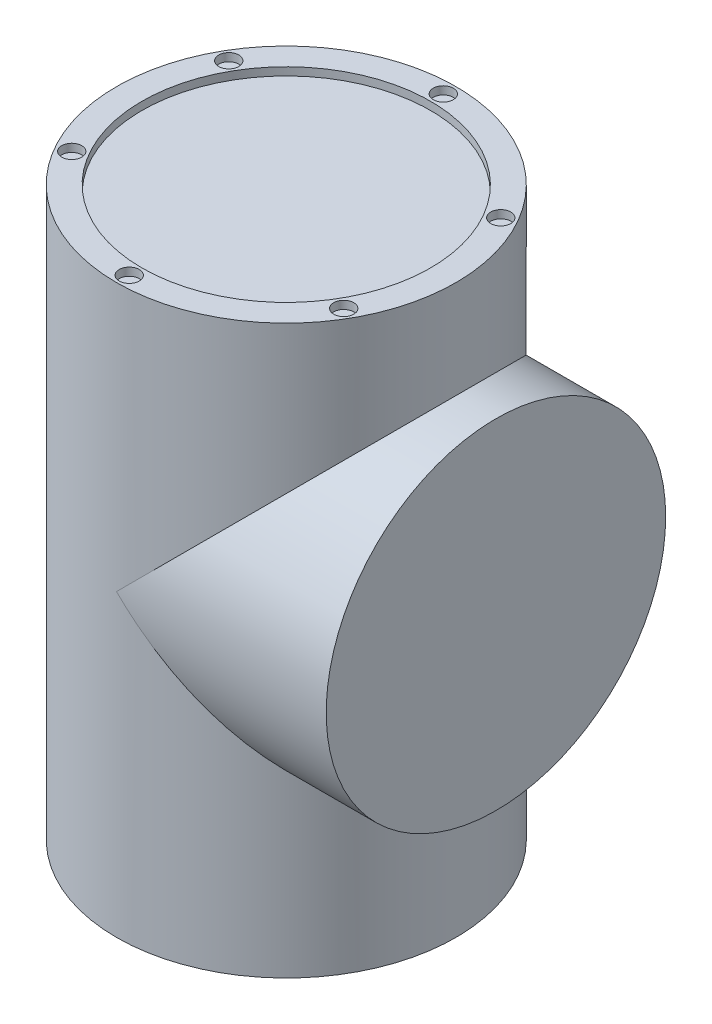
from build123d import *

# Parameters (mm, degrees)
CROQUIS1_R              = 42.5
SALIENTE_EXTRUIR1_DEPTH = 140
CROQUIS2_R              = 42.5
SALIENTE_EXTRUIR2_DEPTH = 52.5
CROQUIS3_R              = 42.5
CROQUIS3_R_2            = 36.143595246
CROQUIS3_R_3            = 2.508178933
SALIENTE_EXTRUIR3_DEPTH = 2


with BuildPart() as part:
    # Croquis1 → Saliente-Extruir1 (new body)
    with BuildSketch(Plane(origin=(0, 0, 0), x_dir=(1, 0, 0), z_dir=(0, 1, 0))):
        with Locations(Location((0, 0, 0), (0, 0, 270))):
            Circle(CROQUIS1_R)
    extrude(amount=SALIENTE_EXTRUIR1_DEPTH)

    # Croquis2 → Saliente-Extruir2 (add)
    with BuildSketch(Plane(origin=(0, 0, 0), x_dir=(0, 0, -1), z_dir=(1, 0, 0))):
        with Locations((0, 75)):
            Circle(CROQUIS2_R)
    extrude(amount=SALIENTE_EXTRUIR2_DEPTH)

    # Croquis3 → Saliente-Extruir3 (add)
    with BuildSketch(Plane(origin=(0, 140, 0), x_dir=(1, 0, 0), z_dir=(0, 1, 0))):
        with Locations(Location((0, 0, 0), (0, 0, 270))):
            Circle(CROQUIS3_R)
        with Locations(Location((0, 0, 0), (0, 0, 270))):
            Circle(CROQUIS3_R_2, mode=Mode.SUBTRACT)
        with Locations(Location((0, 39.319059372, 0), (0, 0, 270))):
            Circle(CROQUIS3_R_3, mode=Mode.SUBTRACT)
        with Locations(Location((34.051304269, 19.659529686, 0), (0, 0, 270))):
            Circle(CROQUIS3_R_3, mode=Mode.SUBTRACT)
        with Locations(Location((34.051304269, -19.659529686, 0), (0, 0, 270))):
            Circle(CROQUIS3_R_3, mode=Mode.SUBTRACT)
        with Locations(Location((0, -39.319059372, 0), (0, 0, 270))):
            Circle(CROQUIS3_R_3, mode=Mode.SUBTRACT)
        with Locations(Location((-34.051304269, -19.659529686, 0), (0, 0, 270))):
            Circle(CROQUIS3_R_3, mode=Mode.SUBTRACT)
        with Locations(Location((-34.051304269, 19.659529686, 0), (0, 0, 270))):
            Circle(CROQUIS3_R_3, mode=Mode.SUBTRACT)
    extrude(amount=SALIENTE_EXTRUIR3_DEPTH)


solid = part.part
